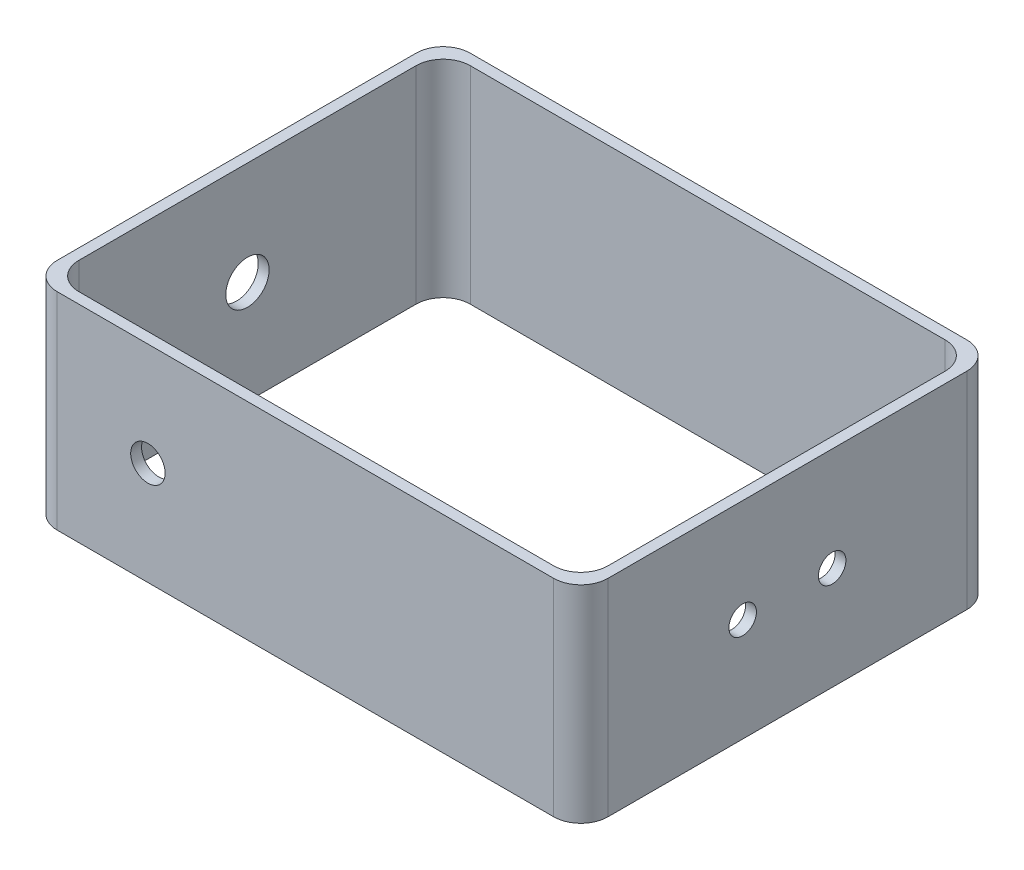
from build123d import *

# Parameters (mm, degrees)
SKETCH1_W           = 101.6
SKETCH1_H           = 76.2
BOSS_EXTRUDE1_DEPTH = 38.1
SKETCH3_W           = 97.6
SKETCH3_H           = 72.2
CUT_EXTRUDE1_DEPTH  = 75.053089065
SKETCH7_R           = 2.54
CUT_EXTRUDE2_DEPTH  = 2
SKETCH9_R           = 4
CUT_EXTRUDE3_DEPTH  = 2
SKETCH11_R          = 3.175
CUT_EXTRUDE4_DEPTH  = 2
FILLET1_R           = 5
FILLET2_R           = 5


with BuildPart() as part:
    # Sketch1 → Boss-Extrude1 (new body)
    with BuildSketch(Plane(origin=(0, 0, 0), x_dir=(1, 0, 0), z_dir=(0, 1, 0))):
        Rectangle(SKETCH1_W, SKETCH1_H)
    extrude(amount=BOSS_EXTRUDE1_DEPTH)

    # Sketch3 → Cut-Extrude1 (cut, through all)
    with BuildSketch(Plane(origin=(0, 38.1, 0), x_dir=(1, 0, 0), z_dir=(0, 1, 0))):
        Rectangle(SKETCH3_W, SKETCH3_H)
    extrude(amount=-CUT_EXTRUDE1_DEPTH, mode=Mode.SUBTRACT)

    # Sketch7 → Cut-Extrude2 (cut)
    with BuildSketch(Plane(origin=(50.8, 0, 0), x_dir=(0, 0, -1), z_dir=(1, 0, 0))):
        with Locations((-8.255, 19.05)):
            Circle(SKETCH7_R)
        with Locations((8.255, 19.05)):
            Circle(SKETCH7_R)
    extrude(amount=-CUT_EXTRUDE2_DEPTH, mode=Mode.SUBTRACT)

    # Sketch9 → Cut-Extrude3 (cut)
    with BuildSketch(Plane.ZY.offset(50.8)):
        with Locations((0, 19.05)):
            Circle(SKETCH9_R)
    extrude(amount=-CUT_EXTRUDE3_DEPTH, mode=Mode.SUBTRACT)

    # Sketch11 → Cut-Extrude4 (cut)
    with BuildSketch(Plane.XY.offset(38.1)):
        with Locations((-29.061160139, 19.05)):
            Circle(SKETCH11_R)
    extrude(amount=-CUT_EXTRUDE4_DEPTH, mode=Mode.SUBTRACT)

    # Fillet1
    fillet1_edges = [part.edges().sort_by_distance(p)[0] for p in [
        (50.8, 19.05, 38.1),
        (-50.8, 19.05, 38.1),
        (-50.8, 19.05, -38.1),
        (50.8, 19.05, -38.1),
    ]]
    fillet(fillet1_edges, radius=FILLET1_R)

    # Fillet2
    fillet2_edges = [part.edges().sort_by_distance(p)[0] for p in [
        (48.8, 19.05, 36.1),
        (-48.8, 19.05, 36.1),
        (-48.8, 19.05, -36.1),
        (48.8, 19.05, -36.1),
    ]]
    fillet(fillet2_edges, radius=FILLET2_R)


solid = part.part
